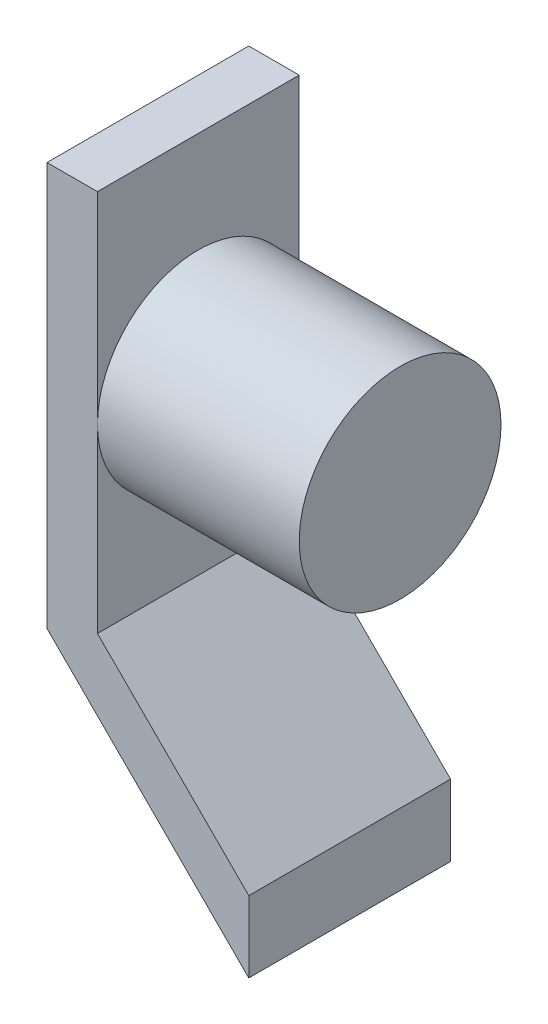
from build123d import *

# Parameters (mm, degrees)
BOSS_EXTRUDE1_DEPTH = 12.7
SKETCH2_R           = 6.35
BOSS_EXTRUDE2_DEPTH = 12.7


with BuildPart() as part:
    # Sketch1 → Boss-Extrude1 (new body)
    with BuildSketch(Plane.XY):
        Polygon((0, 0), (0, 25.4), (3.175, 25.4), (3.175, 22.225), (3.175, 1.315128061), (9.525, -5.034871939), (12.7, -8.209871939), (12.7, -12.7), align=None)
    extrude(amount=BOSS_EXTRUDE1_DEPTH)

    # Sketch2 → Boss-Extrude2 (add)
    with BuildSketch(Plane(origin=(3.175, 0, 0), x_dir=(0, 0, -1), z_dir=(1, 0, 0))):
        with Locations((-6.35, 12.7)):
            Circle(SKETCH2_R)
    extrude(amount=BOSS_EXTRUDE2_DEPTH)


solid = part.part
